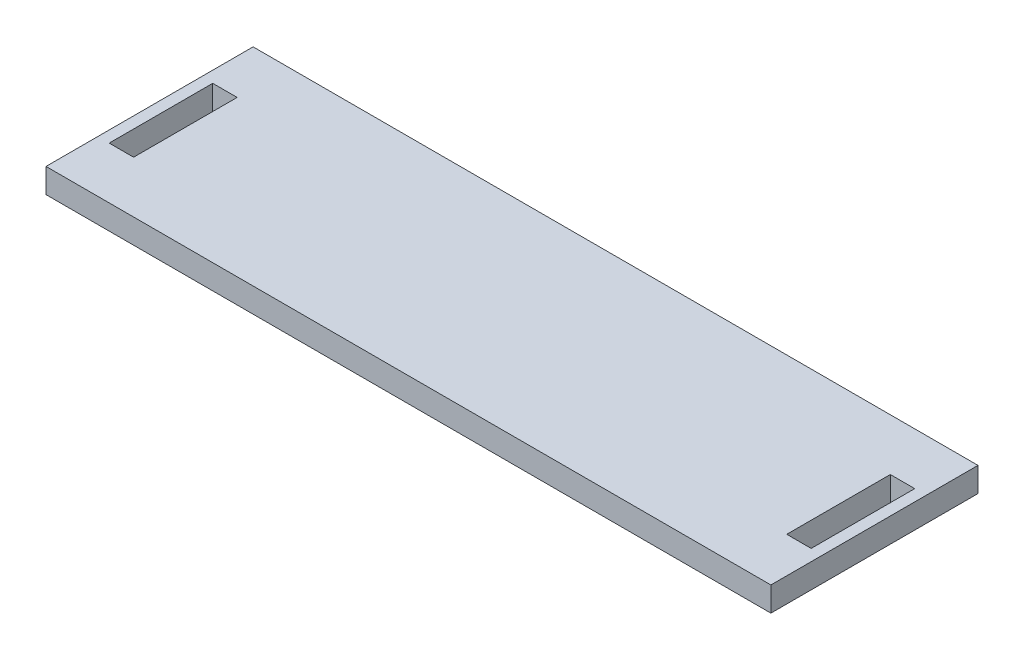
from build123d import *

# Parameters (mm, degrees)
SKETCH1_W           = 177.8
SKETCH1_H           = 50.8
SKETCH1_W_2         = 5.9944
SKETCH1_H_2         = 25.4
BOSS_EXTRUDE1_DEPTH = 5.9944


with BuildPart() as part:
    # Sketch1 → Boss-Extrude1 (new body)
    with BuildSketch(Plane(origin=(0, 0, 0), x_dir=(1, 0, 0), z_dir=(0, 1, 0))):
        with Locations((88.9, -25.4)):
            Rectangle(SKETCH1_W, SKETCH1_H)
        with Locations((5.7912, -25.4)):
            Rectangle(SKETCH1_W_2, SKETCH1_H_2, mode=Mode.SUBTRACT)
        with Locations((171.9856, -25.4)):
            Rectangle(SKETCH1_W_2, SKETCH1_H_2, mode=Mode.SUBTRACT)
    extrude(amount=BOSS_EXTRUDE1_DEPTH)


solid = part.part
